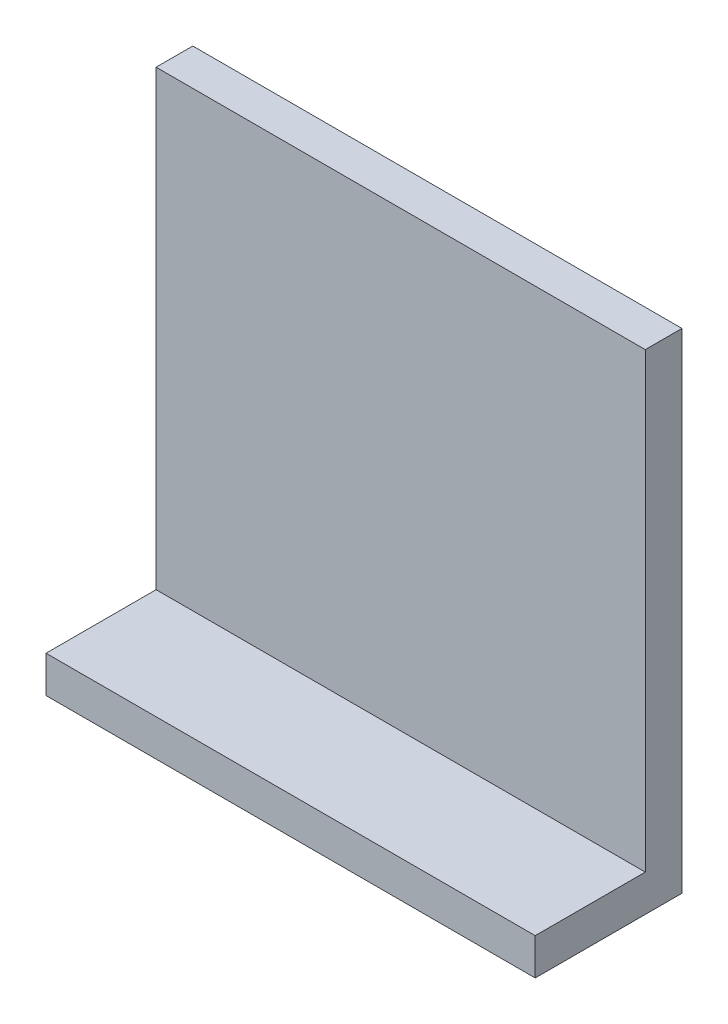
from build123d import *

# Parameters (mm, degrees)
CROQUIS1_W              = 20
CROQUIS1_H              = 20
SALIENTE_EXTRUIR1_DEPTH = 6
CROQUIS2_W              = 4.5
CROQUIS2_H              = 18.5
CORTAR_EXTRUIR1_DEPTH   = 29.91366459


with BuildPart() as part:
    # Croquis1 → Saliente-Extruir1 (new body)
    with BuildSketch(Plane.XY):
        with Locations((10, 10)):
            Rectangle(CROQUIS1_W, CROQUIS1_H)
    extrude(amount=SALIENTE_EXTRUIR1_DEPTH)

    # Croquis2 → Cortar-Extruir1 (cut, through all)
    with BuildSketch(Plane(origin=(20, 0, 0), x_dir=(0, 0, -1), z_dir=(1, 0, 0))):
        with Locations((-3.75, 10.75)):
            Rectangle(CROQUIS2_W, CROQUIS2_H)
    extrude(amount=-CORTAR_EXTRUIR1_DEPTH, mode=Mode.SUBTRACT)


solid = part.part
